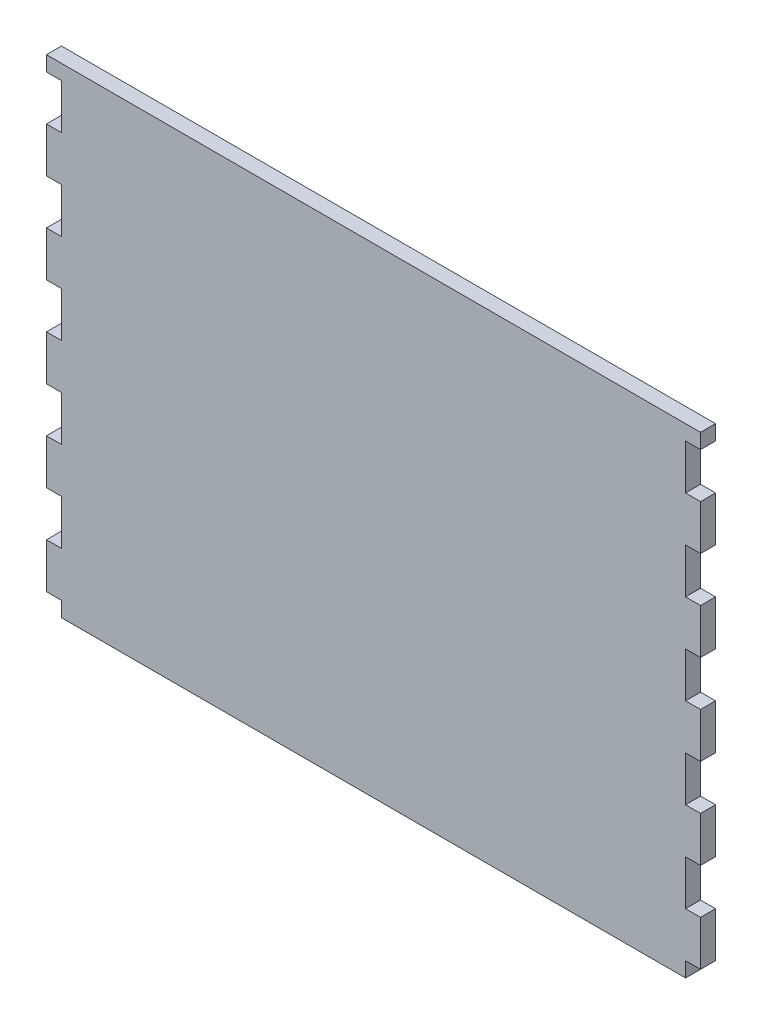
from build123d import *

# Parameters (mm, degrees)
SKETCH1_W               = 276.86
SKETCH1_H               = 203.2
BOSS_EXTRUDE1_DEPTH     = 6.35
SKETCH2_W               = 6.35
SKETCH2_H               = 19.05
CUT_EXTRUDE1_DEPTH      = 172.830577605
LPATTERN1_COUNT         = 6
LPATTERN1_PITCH         = 38.1
MIRROR1_COPY_1_SKETCH_W = 6.35
MIRROR1_COPY_1_SKETCH_H = 19.05
MIRROR1_COPY_1_DEPTH    = 172.830577605
MIRROR1_COPY_2_SKETCH_W = 6.35
MIRROR1_COPY_2_SKETCH_H = 19.05
MIRROR1_COPY_2_DEPTH    = 172.830577605
MIRROR1_COPY_3_SKETCH_W = 6.35
MIRROR1_COPY_3_SKETCH_H = 19.05
MIRROR1_COPY_3_DEPTH    = 172.830577605
MIRROR1_COPY_4_SKETCH_W = 6.35
MIRROR1_COPY_4_SKETCH_H = 19.05
MIRROR1_COPY_4_DEPTH    = 172.830577605
MIRROR1_COPY_5_SKETCH_W = 6.35
MIRROR1_COPY_5_SKETCH_H = 19.05
MIRROR1_COPY_5_DEPTH    = 172.830577605


with BuildPart() as part:
    # Sketch1 → Boss-Extrude1 (new body)
    with BuildSketch(Plane.XY):
        Rectangle(SKETCH1_W, SKETCH1_H)
    extrude(amount=BOSS_EXTRUDE1_DEPTH)

    # Sketch2 → Cut-Extrude1 (cut, through all)
    with BuildSketch(Plane.XY.offset(6.35)):
        with Locations((-135.255, 85.725)):
            Rectangle(SKETCH2_W, SKETCH2_H)
    cut_extrude1 = extrude(amount=-CUT_EXTRUDE1_DEPTH, mode=Mode.SUBTRACT)

    # LPattern1: Cut-Extrude1 ×6
    with Locations(*[(0, -i * LPATTERN1_PITCH, 0) for i in range(1, LPATTERN1_COUNT)]):
        add(cut_extrude1, mode=Mode.SUBTRACT)

    # Mirror1: Cut-Extrude1 across plane
    add(cut_extrude1.mirror(Plane(origin=(0, 0, 0), x_dir=(0, 0, 1), z_dir=(1, 0, 0))), mode=Mode.SUBTRACT)

    # Mirror1 copy 1 sketch → Mirror1 copy 1 (cut, through all)
    with BuildSketch(Plane(origin=(0, -38.1, 6.35), x_dir=(-1, 0, 0), z_dir=(0, 0, 1))):
        with Locations((-135.255, -85.725)):
            Rectangle(MIRROR1_COPY_1_SKETCH_W, MIRROR1_COPY_1_SKETCH_H)
    extrude(amount=-MIRROR1_COPY_1_DEPTH, mode=Mode.SUBTRACT)

    # Mirror1 copy 2 sketch → Mirror1 copy 2 (cut, through all)
    with BuildSketch(Plane(origin=(0, -76.2, 6.35), x_dir=(-1, 0, 0), z_dir=(0, 0, 1))):
        with Locations((-135.255, -85.725)):
            Rectangle(MIRROR1_COPY_2_SKETCH_W, MIRROR1_COPY_2_SKETCH_H)
    extrude(amount=-MIRROR1_COPY_2_DEPTH, mode=Mode.SUBTRACT)

    # Mirror1 copy 3 sketch → Mirror1 copy 3 (cut, through all)
    with BuildSketch(Plane(origin=(0, -114.3, 6.35), x_dir=(-1, 0, 0), z_dir=(0, 0, 1))):
        with Locations((-135.255, -85.725)):
            Rectangle(MIRROR1_COPY_3_SKETCH_W, MIRROR1_COPY_3_SKETCH_H)
    extrude(amount=-MIRROR1_COPY_3_DEPTH, mode=Mode.SUBTRACT)

    # Mirror1 copy 4 sketch → Mirror1 copy 4 (cut, through all)
    with BuildSketch(Plane(origin=(0, -152.4, 6.35), x_dir=(-1, 0, 0), z_dir=(0, 0, 1))):
        with Locations((-135.255, -85.725)):
            Rectangle(MIRROR1_COPY_4_SKETCH_W, MIRROR1_COPY_4_SKETCH_H)
    extrude(amount=-MIRROR1_COPY_4_DEPTH, mode=Mode.SUBTRACT)

    # Mirror1 copy 5 sketch → Mirror1 copy 5 (cut, through all)
    with BuildSketch(Plane(origin=(0, -190.5, 6.35), x_dir=(-1, 0, 0), z_dir=(0, 0, 1))):
        with Locations((-135.255, -85.725)):
            Rectangle(MIRROR1_COPY_5_SKETCH_W, MIRROR1_COPY_5_SKETCH_H)
    extrude(amount=-MIRROR1_COPY_5_DEPTH, mode=Mode.SUBTRACT)


solid = part.part
